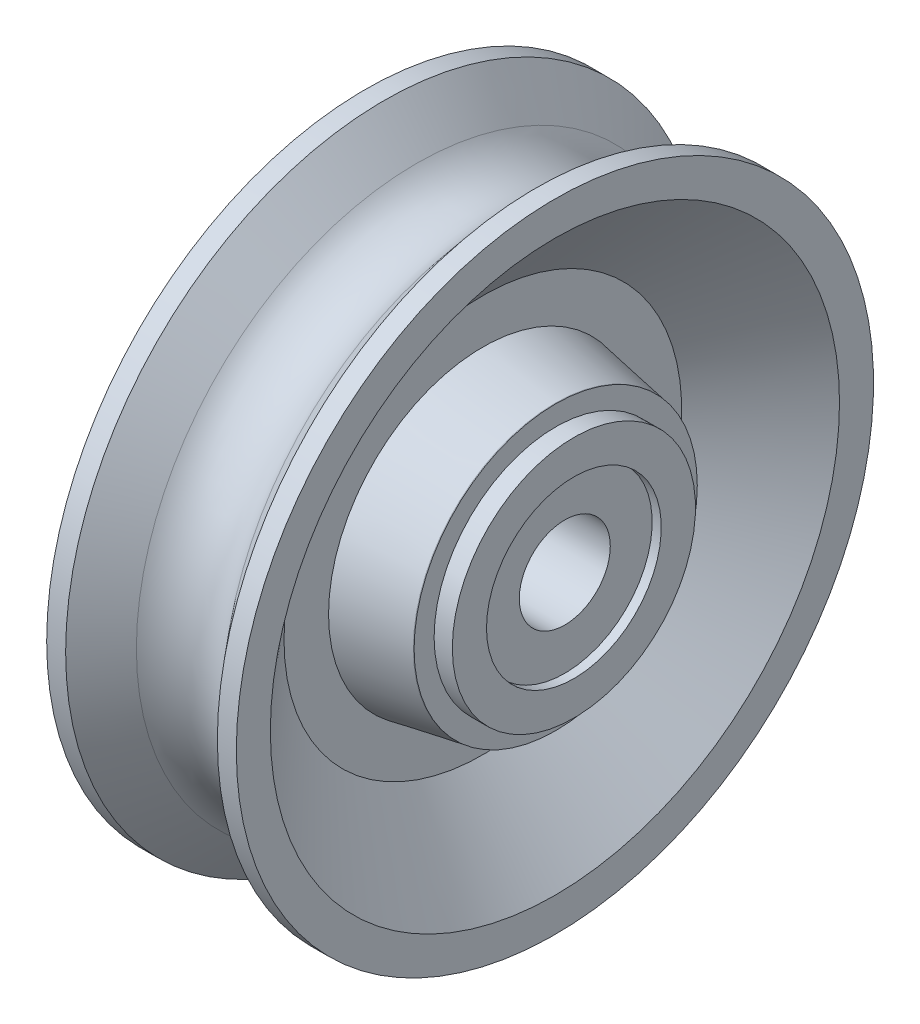
from build123d import *

# Parameters (mm, degrees)
SKETCH4_R          = 11.782777778
SKETCH4_R_2        = 8.480777778
CUT_EXTRUDE2_DEPTH = 1.27
SKETCH5_R          = 6.096
CUT_EXTRUDE3_DEPTH = 0.635


with BuildPart() as part:
    # Sketch1 → Revolve1 (revolve)
    with BuildSketch(Plane.XY, mode=Mode.PRIVATE) as revolve1_sk:
        with BuildLine():
            Line((5.291666667, 22.225), (6.614583333, 22.225))
            Line((6.614583333, 22.225), (6.614583333, 9.877777778))
            Line((6.614583333, 9.877777778), (7.9375, 9.877777778))
            Line((7.9375, 9.877777778), (7.9375, 3.175))
            Line((7.9375, 3.175), (-7.9375, 3.175))
            Line((-7.9375, 3.175), (-7.9375, 9.877777778))
            Line((-7.9375, 9.877777778), (-6.614583333, 9.877777778))
            Line((-6.614583333, 9.877777778), (-6.614583333, 22.225))
            Line((-6.614583333, 22.225), (-5.291666667, 22.225))
            Line((-5.291666667, 22.225), (-3.037856108, 19.544099682))
            ThreePointArc((-3.037856108, 19.544099682), (0, 18.12925), (3.037856108, 19.544099682))
            Line((3.037856108, 19.544099682), (5.291666667, 22.225))
        make_face()
    revolve(revolve1_sk.sketch.rotate(Axis((-7.9375, 0, 0), (1, 0, 0)), 90), axis=Axis((-7.9375, 0, 0), (1, 0, 0)))

    # Sketch2 → Cut-Revolve1 (revolve, cut)
    with BuildSketch(Plane.XY, mode=Mode.PRIVATE) as cut_revolve1_sk:
        Polygon((-7.9375, 9.877777778), (-6.614583333, 9.877777778), (-1.5875, 10.764188204), (-1.5875, 13.87175685), (-7.9375, 21.425061163), align=None)
        Polygon((7.9375, 9.877777778), (7.9375, 21.425061163), (1.5875, 13.87175685), (1.5875, 10.764188204), (6.614583333, 9.877777778), align=None)
    revolve(cut_revolve1_sk.sketch.rotate(Axis((-7.9375, 0, 0), (1, 0, 0)), 90), axis=Axis((-7.9375, 0, 0), (1, 0, 0)), mode=Mode.SUBTRACT)

    # Sketch4 → Cut-Extrude2 (cut)
    with BuildSketch(Plane.ZY.offset(7.9375)):
        Circle(SKETCH4_R)
        Circle(SKETCH4_R_2, mode=Mode.SUBTRACT)
    cut_extrude2 = extrude(amount=-CUT_EXTRUDE2_DEPTH, mode=Mode.SUBTRACT)

    # Sketch5 → Cut-Extrude3 (cut)
    with BuildSketch(Plane.ZY.offset(7.9375)):
        Circle(SKETCH5_R)
    cut_extrude3 = extrude(amount=-CUT_EXTRUDE3_DEPTH, mode=Mode.SUBTRACT)

    # Mirror1: Cut-Extrude2, Cut-Extrude3 across plane
    add(cut_extrude2.mirror(Plane(origin=(0, 0, 0), x_dir=(0, 0, 1), z_dir=(1, 0, 0))), mode=Mode.SUBTRACT)
    add(cut_extrude3.mirror(Plane(origin=(0, 0, 0), x_dir=(0, 0, 1), z_dir=(1, 0, 0))), mode=Mode.SUBTRACT)


solid = part.part
